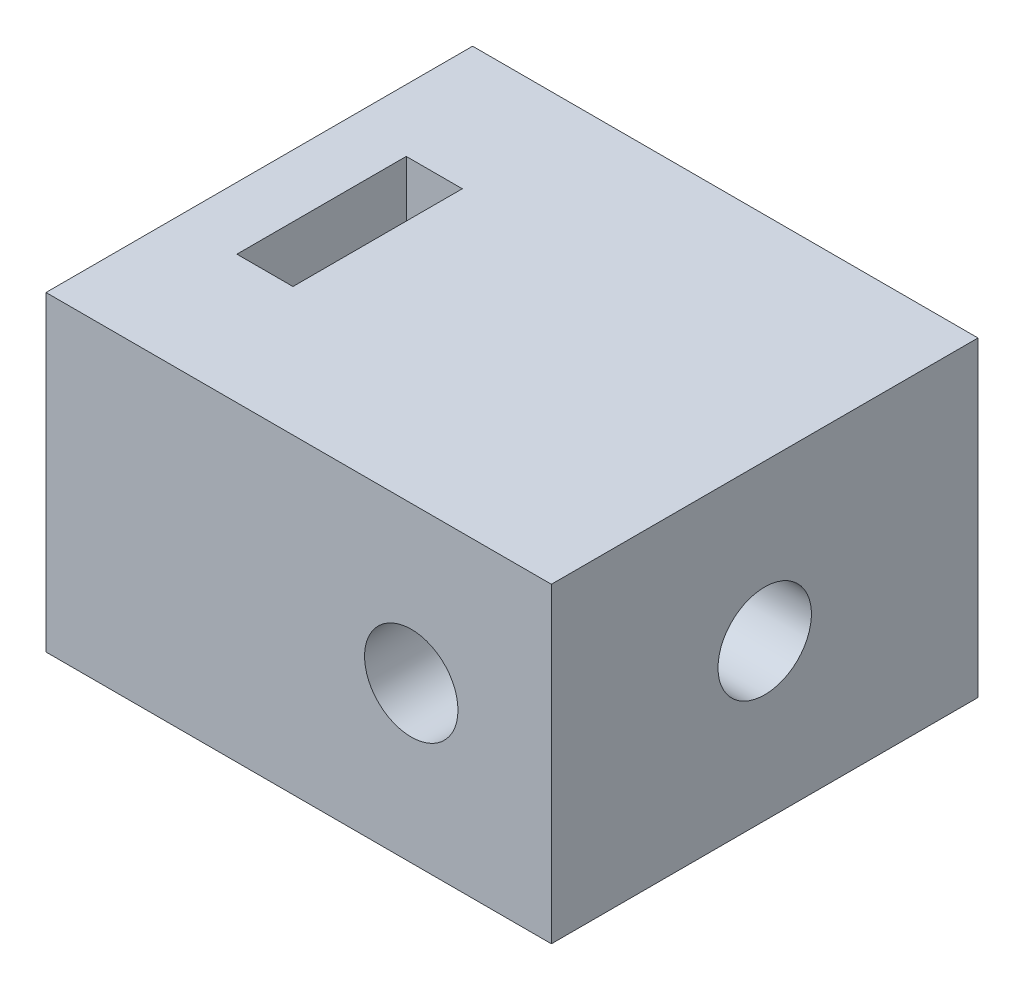
from build123d import *

# Parameters (mm, degrees)
SKETCH1_W           = 16.41
SKETCH1_H           = 13.7
BOSS_EXTRUDE1_DEPTH = 10
SKETCH2_R           = 1.5
CUT_EXTRUDE1_DEPTH  = 19.841762789
SKETCH3_R           = 1.5
CUT_EXTRUDE2_DEPTH  = 21.401240158
SKETCH5_W           = 0.18
SKETCH5_H           = 13.7
CUT_EXTRUDE4_DEPTH  = 15.637094145
CUT_EXTRUDE3_DEPTH  = 1.8
SKETCH6_W           = 1.8
SKETCH6_H           = 5.438639536
CUT_EXTRUDE5_DEPTH  = 5


with BuildPart() as part:
    # Sketch1 → Boss-Extrude1 (new body)
    with BuildSketch(Plane(origin=(0, 0, 0), x_dir=(1, 0, 0), z_dir=(0, 1, 0))):
        Rectangle(SKETCH1_W, SKETCH1_H)
    extrude(amount=BOSS_EXTRUDE1_DEPTH)

    # Sketch2 → Cut-Extrude1 (cut, through all)
    with BuildSketch(Plane.XY.offset(6.85)):
        with Locations((3.705, 5)):
            Circle(SKETCH2_R)
    extrude(amount=-CUT_EXTRUDE1_DEPTH, mode=Mode.SUBTRACT)

    # Sketch3 → Cut-Extrude2 (cut, through all)
    with BuildSketch(Plane.ZY.offset(8.205)):
        with Locations((0, 5)):
            Circle(SKETCH3_R)
    extrude(amount=-CUT_EXTRUDE2_DEPTH, mode=Mode.SUBTRACT)

    # Sketch5 → Cut-Extrude4 (cut, through all)
    with BuildSketch(Plane(origin=(0, 10, 0), x_dir=(1, 0, 0), z_dir=(0, 1, 0))):
        with Locations((-8.115, 0)):
            Rectangle(SKETCH5_W, SKETCH5_H)
    extrude(amount=-CUT_EXTRUDE4_DEPTH, mode=Mode.SUBTRACT)

    # Sketch4 → Cut-Extrude3 (cut)
    with BuildSketch(Plane.ZY.offset(6.025)):
        Polygon((2.719319768, 5), (1.359659884, 7.355), (-1.359659884, 7.355), (-2.719319768, 5), (-1.359659884, 2.645), (1.359659884, 2.645), align=None)
    extrude(amount=-CUT_EXTRUDE3_DEPTH, mode=Mode.SUBTRACT)

    # Sketch6 → Cut-Extrude5 (cut)
    with BuildSketch(Plane(origin=(0, 10, 0), x_dir=(1, 0, 0), z_dir=(0, 1, 0))):
        with Locations((-5.125, 0)):
            Rectangle(SKETCH6_W, SKETCH6_H)
    extrude(amount=-CUT_EXTRUDE5_DEPTH, mode=Mode.SUBTRACT)


solid = part.part
